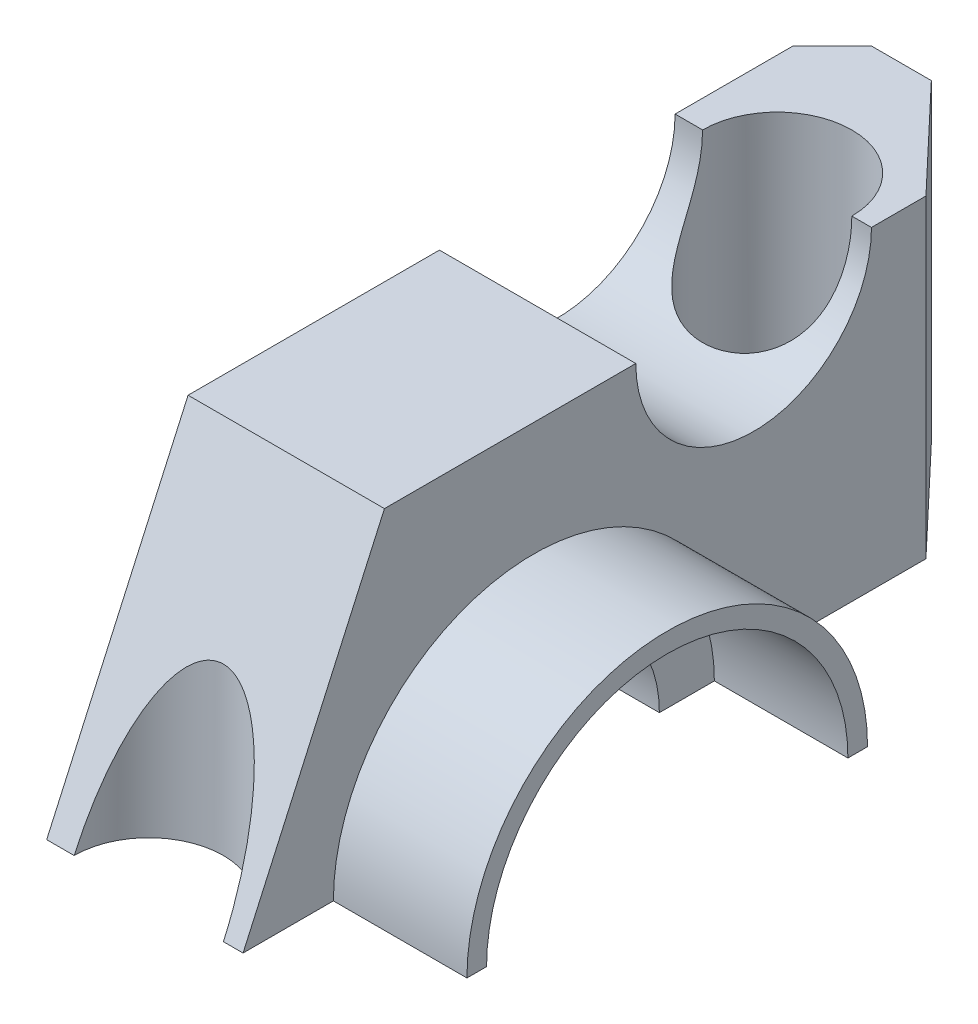
from build123d import *

# Parameters (mm, degrees)
SALIENTE_EXTRUIR1_DEPTH    = 25
CORTAR_EXTRUIR1_DEPTH      = 54
CORTAR_EXTRUIR1_DEPTH_BACK = 94
CROQUIS2_R                 = 9.5
CORTAR_EXTRUIR2_DEPTH      = 94
CORTAR_EXTRUIR2_DEPTH_BACK = 94
CROQUIS3_R                 = 15
CROQUIS3_R_2               = 16
CORTAR_EXTRUIR3_DEPTH      = 94
CORTAR_EXTRUIR3_DEPTH_BACK = 94
CHAFL_N2_SIZE              = 5
SALIENTE_EXTRUIR2_DEPTH    = 17


with BuildPart() as part:
    # Croquis1 → Saliente-Extruir1 (new body)
    with BuildSketch(Plane(origin=(0, 0, 0), x_dir=(0, 0, -1), z_dir=(1, 0, 0))):
        Polygon((-100, 0), (-82, 40), (0, 40), (0, 0), align=None)
    extrude(amount=SALIENTE_EXTRUIR1_DEPTH)

    # Croquis2 → Cortar-Extruir1 (cut, two sides: drawn at the far end of the back side and taken through both)
    with BuildSketch(Plane(origin=(0, 40, 0), x_dir=(1, 0, 0), z_dir=(0, 1, 0)).offset(-CORTAR_EXTRUIR1_DEPTH_BACK)):
        with Locations((13, -100)):
            Circle(CROQUIS2_R)
        with Locations((13, -20)):
            Circle(CROQUIS2_R)
    extrude(amount=CORTAR_EXTRUIR1_DEPTH + CORTAR_EXTRUIR1_DEPTH_BACK, mode=Mode.SUBTRACT)

    # Croquis3 → Cortar-Extruir2 (cut, two sides: drawn at the far end of the back side and taken through both)
    with BuildSketch(Plane(origin=(25, 0, 0), x_dir=(0, 0, -1), z_dir=(1, 0, 0)).offset(-CORTAR_EXTRUIR2_DEPTH_BACK)):
        with Locations((-35, 40)):
            Circle(CROQUIS3_R)
        with Locations((-63, 0)):
            Circle(CROQUIS3_R_2)
    extrude(amount=CORTAR_EXTRUIR2_DEPTH + CORTAR_EXTRUIR2_DEPTH_BACK, mode=Mode.SUBTRACT)

    # Croquis4 → Cortar-Extruir3 (cut, two sides: drawn at the far end of the back side and taken through both)
    with BuildSketch(Plane(origin=(0, 40, 0), x_dir=(1, 0, 0), z_dir=(0, 1, 0)).offset(-CORTAR_EXTRUIR3_DEPTH_BACK)):
        Polygon((12.62, 0), (25, -13.066583333), (25, 0), align=None)
    extrude(amount=CORTAR_EXTRUIR3_DEPTH + CORTAR_EXTRUIR3_DEPTH_BACK, mode=Mode.SUBTRACT)

    # Chaflán2
    chafl_n2_edges = [part.edges().sort_by_distance(p)[0] for p in [
        (0, 20, 0),
    ]]
    chamfer(chafl_n2_edges, length=CHAFL_N2_SIZE)

    # Croquis5 → Saliente-Extruir2 (add)
    with BuildSketch(Plane(origin=(25, 0, 0), x_dir=(0, 0, -1), z_dir=(1, 0, 0))):
        with BuildLine():
            Line((-88.5, 0), (-86, 0))
            ThreePointArc((-86, 0), (-63, 23), (-40, 0))
            Line((-40, 0), (-37.5, 0))
            ThreePointArc((-37.5, 0), (-63, 25.5), (-88.5, 0))
        make_face()
    extrude(amount=SALIENTE_EXTRUIR2_DEPTH)


solid = part.part
